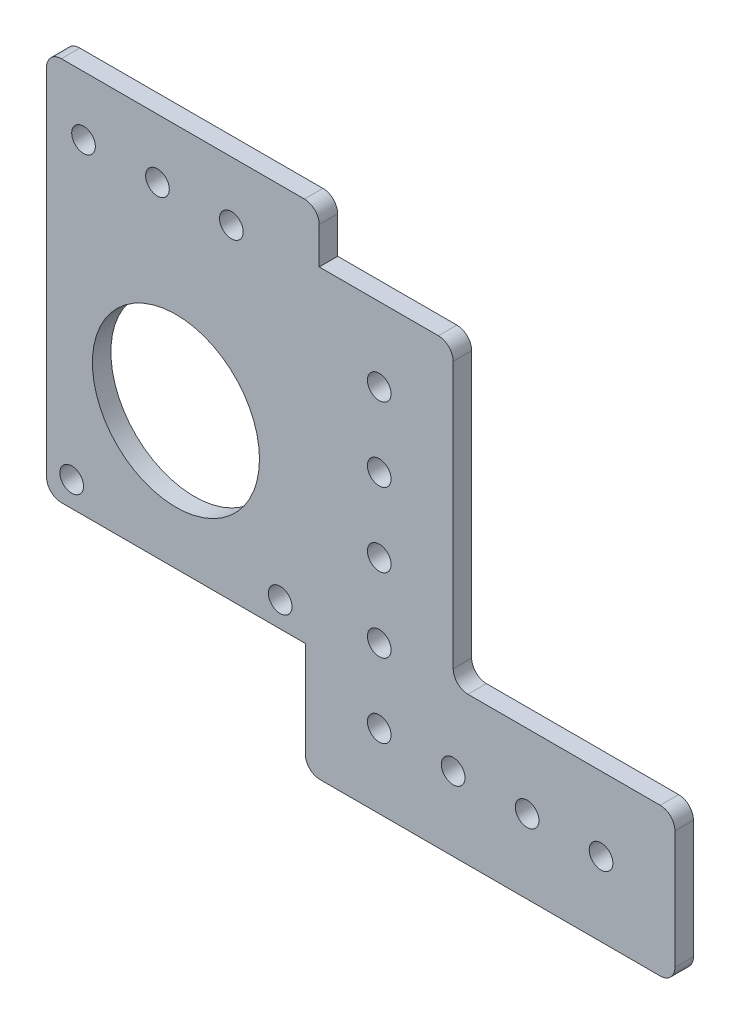
from build123d import *

# Parameters (mm, degrees)
SKETCH1_R           = 2.032
SKETCH1_R_2         = 14.351
SKETCH1_W           = 25.4
SKETCH1_H           = 76.2
BOSS_EXTRUDE1_DEPTH = 3.175
SKETCH2_R           = 2.032
CUT_EXTRUDE1_DEPTH  = 69.759094853
SKETCH4_W           = 3.175
SKETCH4_H           = 25.4
BOSS_EXTRUDE2_DEPTH = 38.1
SKETCH5_R           = 2.032
CUT_EXTRUDE2_DEPTH  = 69.759094853
FILLET5_R           = 2.54
SKETCH6_W           = 46.838855708
SKETCH6_H           = 19.05
BOSS_EXTRUDE3_DEPTH = 3.175
SKETCH7_R           = 2.032
CUT_EXTRUDE3_DEPTH  = 75.018388912
FILLET6_R           = 2.54


with BuildPart() as part:
    # Sketch1 → Boss-Extrude1 (new body)
    # profile 1 of 2: a face of its own
    with BuildSketch(Plane.XY):
        Polygon((-57.15, -19.108999882), (-12.7, -19.108999882), (-12.7, 24.638), (-12.7, 27.881000118), (-57.15, 27.881000118), align=None)
        with Locations((-52.832, -14.790999882)):
            Circle(SKETCH1_R, mode=Mode.SUBTRACT)
        with Locations((-17.018, -14.790999882)):
            Circle(SKETCH1_R, mode=Mode.SUBTRACT)
        with Locations((-34.925, 4.386000118)):
            Circle(SKETCH1_R_2, mode=Mode.SUBTRACT)
    # profile 2 of 2: a face of its own
    with BuildSketch(Plane.XY):
        Rectangle(SKETCH1_W, SKETCH1_H)
    extrude(amount=BOSS_EXTRUDE1_DEPTH)

    # Sketch2 → Cut-Extrude1 (cut, through all)
    with BuildSketch(Plane.XY.offset(3.175)):
        Circle(SKETCH2_R)
        with Locations((0, 12.7)):
            Circle(SKETCH2_R)
        with Locations((0, 25.4)):
            Circle(SKETCH2_R)
        with Locations((0, -12.7)):
            Circle(SKETCH2_R)
        with Locations((0, -25.4)):
            Circle(SKETCH2_R)
    extrude(amount=-CUT_EXTRUDE1_DEPTH, mode=Mode.SUBTRACT)

    # Sketch4 → Boss-Extrude2 (add)
    with BuildSketch(Plane(origin=(12.7, 0, 0), x_dir=(0, 0, -1), z_dir=(1, 0, 0))):
        with Locations((-1.5875, -25.4)):
            Rectangle(SKETCH4_W, SKETCH4_H)
    extrude(amount=BOSS_EXTRUDE2_DEPTH)

    # Sketch5 → Cut-Extrude2 (cut, through all)
    with BuildSketch(Plane(origin=(0, 0, 0), x_dir=(-1, 0, 0), z_dir=(0, 0, -1))):
        with Locations(Location((0, -25.4, 0), (0, 0, 180))):
            Circle(SKETCH5_R)
        with Locations((-12.7, -25.4)):
            Circle(SKETCH5_R)
        with Locations((-25.4, -25.4)):
            Circle(SKETCH5_R)
        with Locations((-38.1, -25.4)):
            Circle(SKETCH5_R)
    extrude(amount=-CUT_EXTRUDE2_DEPTH, mode=Mode.SUBTRACT)

    # Fillet5
    fillet5_edges = [part.edges().sort_by_distance(p)[0] for p in [
        (12.7, 38.1, 1.5875),
        (-12.7, -38.1, 1.5875),
        (-57.15, -19.108999882, 1.5875),
        (12.7, -12.7, 1.5875),
        (50.8, -38.1, 1.5875),
        (50.8, -12.7, 1.5875),
    ]]
    fillet(fillet5_edges, radius=FILLET5_R)

    # Sketch6 → Boss-Extrude3 (add)
    with BuildSketch(Plane(origin=(0, 0, 0), x_dir=(-1, 0, 0), z_dir=(0, 0, -1))):
        with Locations((33.730572146, 37.406000118)):
            Rectangle(SKETCH6_W, SKETCH6_H)
    extrude(amount=-BOSS_EXTRUDE3_DEPTH)

    # Sketch7 → Cut-Extrude3 (cut, through all)
    with BuildSketch(Plane(origin=(0, 0, 0), x_dir=(-1, 0, 0), z_dir=(0, 0, -1))):
        with Locations((25.4, 36.771000118)):
            Circle(SKETCH7_R)
        with Locations((38.1, 36.771000118)):
            Circle(SKETCH7_R)
        with Locations((50.8, 36.771000118)):
            Circle(SKETCH7_R)
    extrude(amount=-CUT_EXTRUDE3_DEPTH, mode=Mode.SUBTRACT)

    # Fillet6
    fillet6_edges = [part.edges().sort_by_distance(p)[0] for p in [
        (-10.311144292, 46.931000118, 1.5875),
        (-57.15, 46.931000118, 1.5875),
    ]]
    fillet(fillet6_edges, radius=FILLET6_R)


solid = part.part
